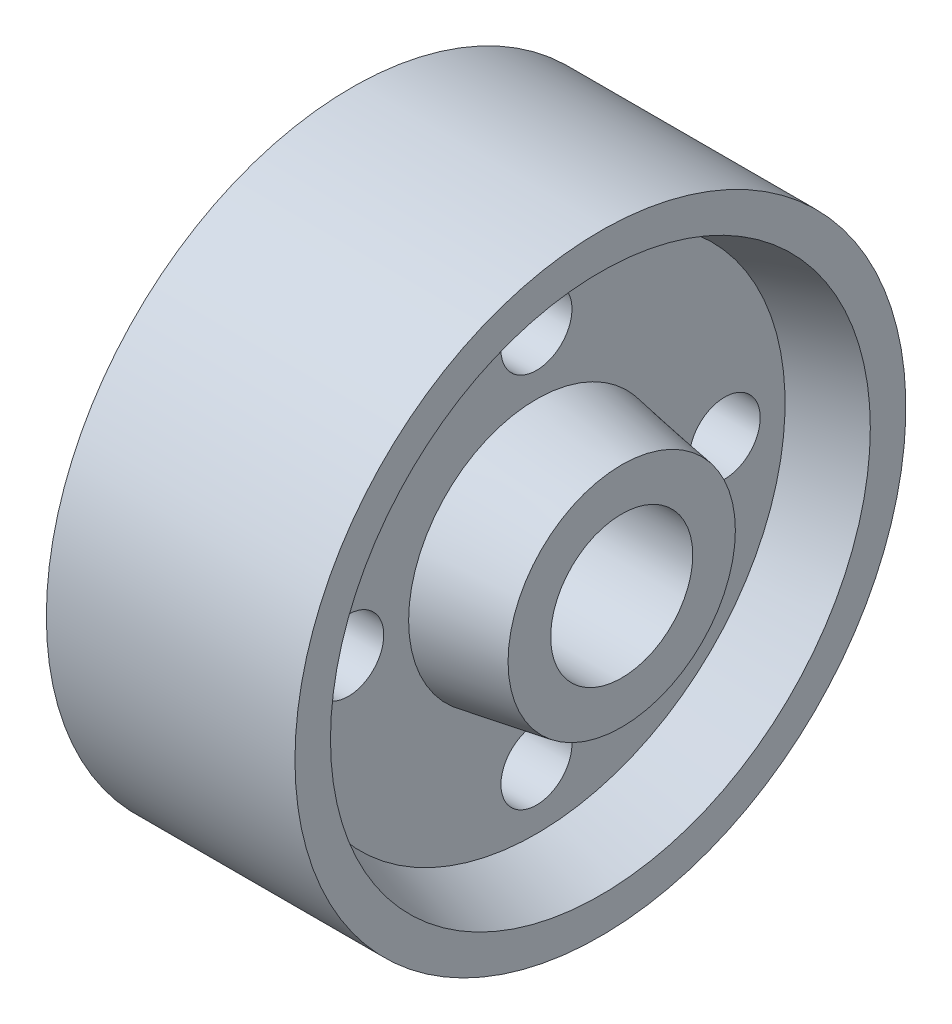
from build123d import *

# Parameters (mm, degrees)
SKETCH4_R          = 5
CUT_EXTRUDE4_DEPTH = 68.372101051
SKETCH6_R          = 10
CUT_EXTRUDE5_DEPTH = 74.341666193


with BuildPart() as part:
    # Sketch1 → Revolve3 (revolve)
    with BuildSketch(Plane(origin=(0, 0, 0), x_dir=(1, 0, 0), z_dir=(0, 1, 0)), mode=Mode.PRIVATE) as revolve3_sk:
        Polygon((0, 0), (0, 16), (12, 18), (12, 35), (3, 38), (3, 43), (38, 43), (38, 38), (29, 35), (29, 18), (41, 16), (41, 0), align=None)
    revolve(revolve3_sk.sketch.rotate(Axis((0, 0, 0), (1, 0, 0)), 180), axis=Axis((0, 0, 0), (1, 0, 0)))

    # Sketch4 → Cut-Extrude4 (cut, through all)
    with BuildSketch(Plane.ZY.offset(-12)):
        with Locations((0, 26.5)):
            Circle(SKETCH4_R)
        with Locations((26.5, 0)):
            Circle(SKETCH4_R)
        with Locations((0, -26.5)):
            Circle(SKETCH4_R)
        with Locations((-26.5, 0)):
            Circle(SKETCH4_R)
    extrude(amount=-CUT_EXTRUDE4_DEPTH, mode=Mode.SUBTRACT)

    # Sketch6 → Cut-Extrude5 (cut, through all)
    with BuildSketch(Plane(origin=(41, 0, 0), x_dir=(0, 0, -1), z_dir=(1, 0, 0))):
        Circle(SKETCH6_R)
    extrude(amount=-CUT_EXTRUDE5_DEPTH, mode=Mode.SUBTRACT)


solid = part.part
